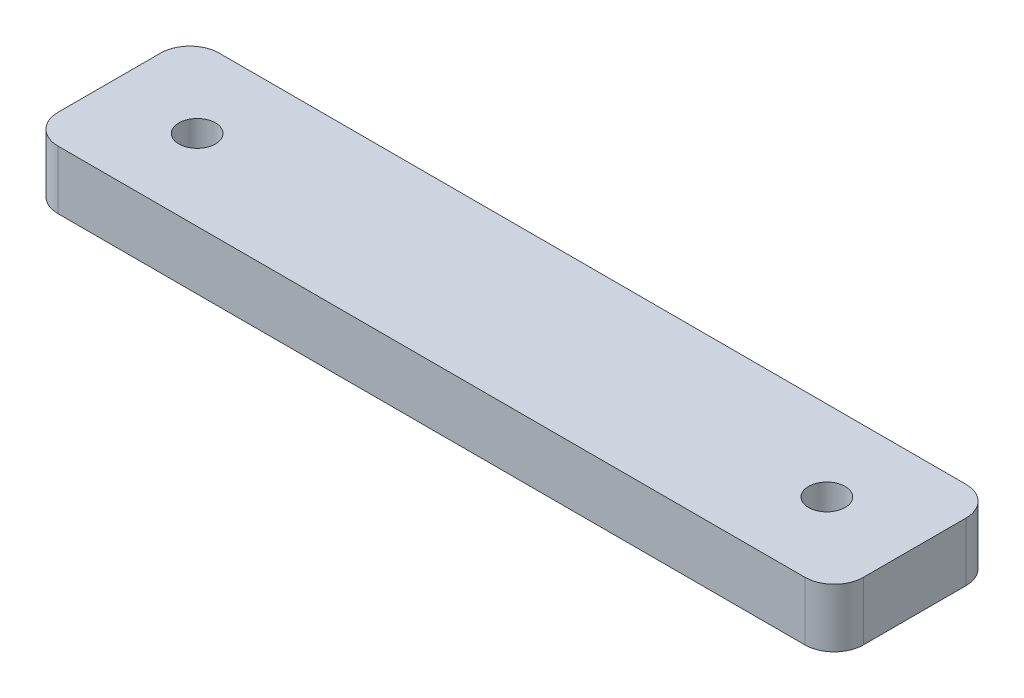
from build123d import *

# Parameters (mm, degrees)
CROQUIS1_W              = 27.5
CROQUIS1_H              = 5.5
CROQUIS1_R              = 0.625
SALIENTE_EXTRUIR1_DEPTH = 2
REDONDEO1_R             = 1


with BuildPart() as part:
    # Croquis1 → Saliente-Extruir1 (new body)
    with BuildSketch(Plane(origin=(0, 0, 0), x_dir=(1, 0, 0), z_dir=(0, 1, 0))):
        Rectangle(CROQUIS1_W, CROQUIS1_H)
        with Locations(Location((-10.75, 0, 0), (0, 0, 270))):
            Circle(CROQUIS1_R, mode=Mode.SUBTRACT)
        with Locations(Location((10.75, 0, 0), (0, 0, 90))):
            Circle(CROQUIS1_R, mode=Mode.SUBTRACT)
    extrude(amount=SALIENTE_EXTRUIR1_DEPTH)

    # Redondeo1
    redondeo1_edges = [part.edges().sort_by_distance(p)[0] for p in [
        (13.75, 1, 2.75),
        (-13.75, 1, 2.75),
        (-13.75, 1, -2.75),
        (13.75, 1, -2.75),
    ]]
    fillet(redondeo1_edges, radius=REDONDEO1_R)


solid = part.part
